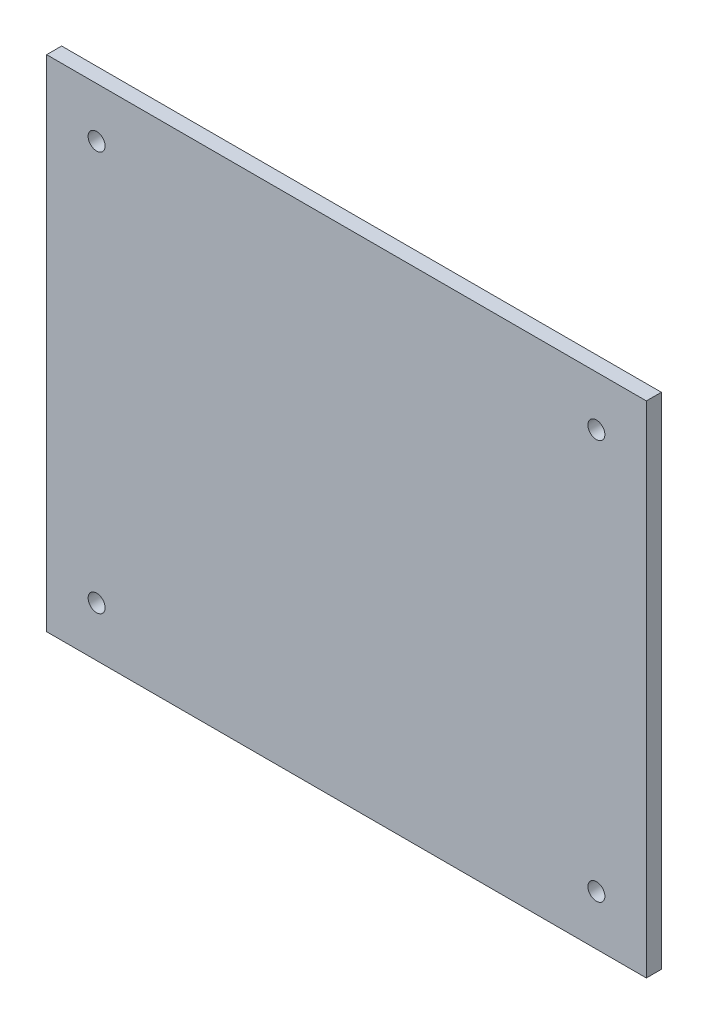
from build123d import *

# Parameters (mm, degrees)
CAMERA_REMOVABLE_PANEL_W = 120
CAMERA_REMOVABLE_PANEL_H = 100
CAMERA_REMOVABLE_PANEL_R = 1.7
F_3MM_DEPTH              = 3


with BuildPart() as part:
    # 外形与孔位_camera_removable_panel → 板厚_3mm (new body)
    with BuildSketch(Plane.XY):
        with Locations((60, 50)):
            Rectangle(CAMERA_REMOVABLE_PANEL_W, CAMERA_REMOVABLE_PANEL_H)
        with Locations((10, 10)):
            Circle(CAMERA_REMOVABLE_PANEL_R, mode=Mode.SUBTRACT)
        with Locations((10, 90)):
            Circle(CAMERA_REMOVABLE_PANEL_R, mode=Mode.SUBTRACT)
        with Locations((110, 10)):
            Circle(CAMERA_REMOVABLE_PANEL_R, mode=Mode.SUBTRACT)
        with Locations((110, 90)):
            Circle(CAMERA_REMOVABLE_PANEL_R, mode=Mode.SUBTRACT)
    extrude(amount=F_3MM_DEPTH)


solid = part.part
